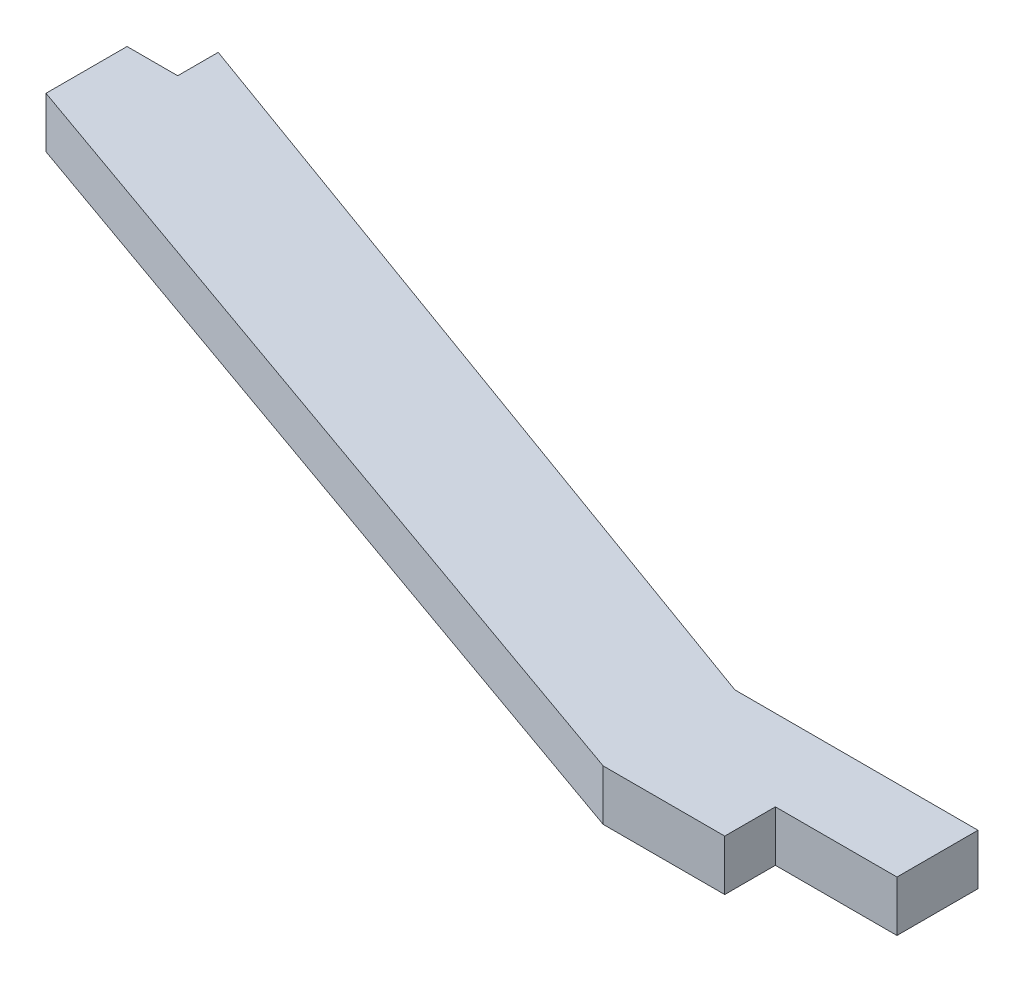
from build123d import *

# Parameters (mm, degrees)
BOSS_EXTRUDE1_DEPTH = 3.175


with BuildPart() as part:
    # Sketch2 → Boss-Extrude1 (new body)
    with BuildSketch(Plane(origin=(0, 0, 0), x_dir=(1, 0, 0), z_dir=(0, 1, 0))):
        Polygon((0, 0), (0, -5.08), (53.975, -24.13), (61.595, -24.13), (61.595, -20.955), (69.215, -20.955), (69.215, -15.875), (53.975, -15.875), (3.175, 2.54), (3.175, 0), align=None)
    extrude(amount=BOSS_EXTRUDE1_DEPTH)


solid = part.part
